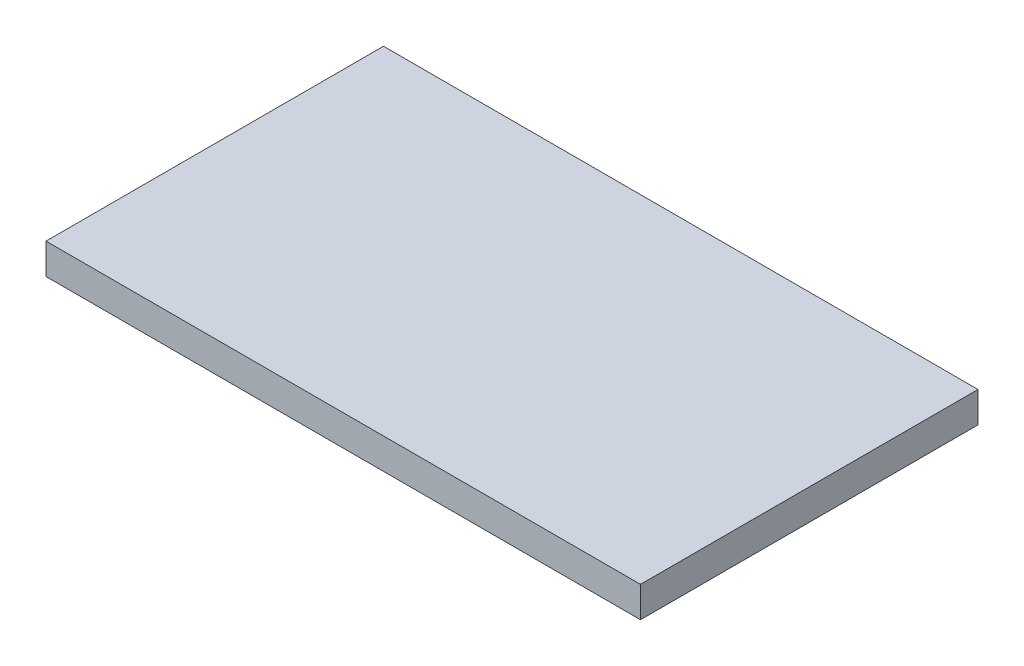
from build123d import *

# Parameters (mm, degrees)
EXTRUDE_1_DEPTH = 1.6


with BuildPart() as part:
    # 草图1 → 凸台-拉伸1 (new body)
    with BuildSketch(Plane(origin=(0, 0, 0), x_dir=(1, 0, 0), z_dir=(0, 1, 0))):
        Polygon((0, 8.8), (15.5, 8.8), (15.5, -8.8), (-15.5, -8.8), (-15.5, 8.8), align=None)
    extrude(amount=EXTRUDE_1_DEPTH)


solid = part.part
